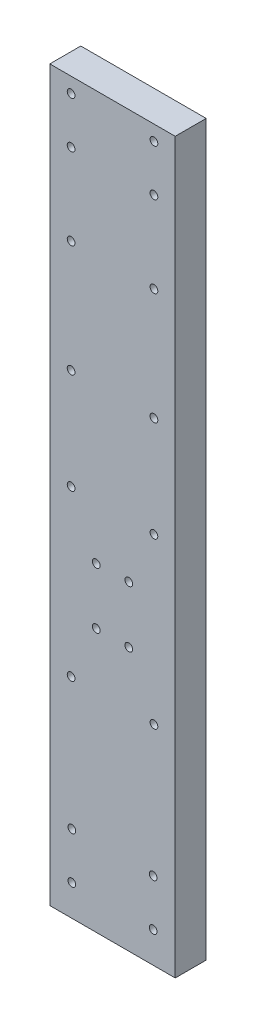
from build123d import *

# Parameters (mm, degrees)
SKETCH3_W           = 16.2
SKETCH3_H           = 94.16
SKETCH3_R           = 0.5
BOSS_EXTRUDE3_DEPTH = 4


with BuildPart() as part:
    # Sketch3 → Boss-Extrude3 (new body)
    with BuildSketch(Plane.XY):
        with Locations((8.1, 46.926448831)):
            Rectangle(SKETCH3_W, SKETCH3_H)
        with Locations((6, 33.846448831)):
            Circle(SKETCH3_R, mode=Mode.SUBTRACT)
        with Locations((10.2, 33.846448831)):
            Circle(SKETCH3_R, mode=Mode.SUBTRACT)
        with Locations((2.75, 86.061448831)):
            Circle(SKETCH3_R, mode=Mode.SUBTRACT)
        with Locations((10.2, 41.166448831)):
            Circle(SKETCH3_R, mode=Mode.SUBTRACT)
        with Locations((13.45, 48.106448831)):
            Circle(SKETCH3_R, mode=Mode.SUBTRACT)
        with Locations((2.75, 92.061448831)):
            Circle(SKETCH3_R, mode=Mode.SUBTRACT)
        with Locations((13.45, 86.061448831)):
            Circle(SKETCH3_R, mode=Mode.SUBTRACT)
        with Locations((2.75, 61.106448831)):
            Circle(SKETCH3_R, mode=Mode.SUBTRACT)
        with Locations((2.85, 9.846448831)):
            Circle(SKETCH3_R, mode=Mode.SUBTRACT)
        with Locations((13.35, 9.846448831)):
            Circle(SKETCH3_R, mode=Mode.SUBTRACT)
        with Locations((13.35, 3.846448831)):
            Circle(SKETCH3_R, mode=Mode.SUBTRACT)
        with Locations((2.85, 3.846448831)):
            Circle(SKETCH3_R, mode=Mode.SUBTRACT)
        with Locations((13.45, 61.106448831)):
            Circle(SKETCH3_R, mode=Mode.SUBTRACT)
        with Locations((2.75, 75.561448831)):
            Circle(SKETCH3_R, mode=Mode.SUBTRACT)
        with Locations((13.45, 26.846448831)):
            Circle(SKETCH3_R, mode=Mode.SUBTRACT)
        with Locations((13.45, 75.561448831)):
            Circle(SKETCH3_R, mode=Mode.SUBTRACT)
        with Locations((13.45, 92.061448831)):
            Circle(SKETCH3_R, mode=Mode.SUBTRACT)
        with Locations((2.75, 26.846448831)):
            Circle(SKETCH3_R, mode=Mode.SUBTRACT)
        with Locations((6, 41.106448831)):
            Circle(SKETCH3_R, mode=Mode.SUBTRACT)
        with Locations((2.75, 48.106448831)):
            Circle(SKETCH3_R, mode=Mode.SUBTRACT)
    extrude(amount=BOSS_EXTRUDE3_DEPTH)


solid = part.part
